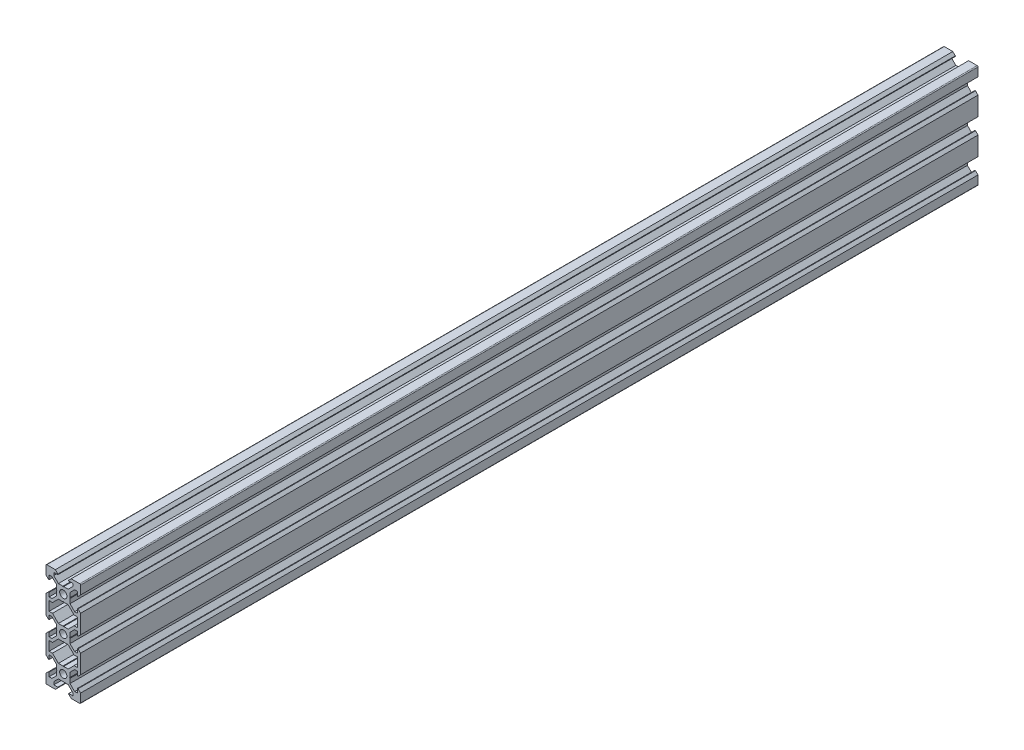
from build123d import *

# Parameters (mm, degrees)
BOSS_EXTRU_1_DEPTH = 519.38


with BuildPart() as part:
    # Esquisse1 → Boss.-Extru.1 (new body)
    with BuildSketch(Plane.XY):
        with BuildLine():
            Line((-9.5, 10), (-4.58, 10))
            Line((-4.58, 10), (-3.125, 8.545))
            Line((-3.125, 8.545), (-3.125, 8.2))
            Line((-3.125, 8.2), (-5.5, 8.2))
            Line((-5.5, 8.2), (-5.5, 6.560660172))
            Line((-5.5, 6.560660172), (-2.839339828, 3.9))
            Line((-2.839339828, 3.9), (-0.21, 3.9))
            Line((-0.21, 3.9), (0, 3.69))
            Line((0, 3.69), (0, 2.1))
            ThreePointArc((0, 2.1), (-2.1, 0), (0, -2.1))
            Line((0, -2.1), (0, -3.69))
            Line((0, -3.69), (-0.21, -3.9))
            Line((-0.21, -3.9), (-2.839339828, -3.9))
            Line((-2.839339828, -3.9), (-6.239339828, -7.3))
            Line((-6.239339828, -7.3), (-8.2, -7.3))
            Line((-8.2, -7.3), (-8.2, -12.7))
            Line((-8.2, -12.7), (-6.239339828, -12.7))
            Line((-6.239339828, -12.7), (-2.839339828, -16.1))
            Line((-2.839339828, -16.1), (-0.21, -16.1))
            Line((-0.21, -16.1), (0, -16.31))
            Line((0, -16.31), (0, -17.9))
            ThreePointArc((0, -17.9), (-2.1, -20), (0, -22.1))
            Line((0, -22.1), (0, -23.69))
            Line((0, -23.69), (-0.21, -23.9))
            Line((-0.21, -23.9), (-2.839339828, -23.9))
            Line((-2.839339828, -23.9), (-6.239339828, -27.3))
            Line((-6.239339828, -27.3), (-8.2, -27.3))
            Line((-8.2, -27.3), (-8.2, -32.7))
            Line((-8.2, -32.7), (-6.239339828, -32.7))
            Line((-6.239339828, -32.7), (-2.839339828, -36.1))
            Line((-2.839339828, -36.1), (-0.21, -36.1))
            Line((-0.21, -36.1), (0, -36.31))
            Line((0, -36.31), (0, -37.9))
            ThreePointArc((0, -37.9), (-2.1, -40), (0, -42.1))
            Line((0, -42.1), (0, -43.69))
            Line((0, -43.69), (-0.21, -43.9))
            Line((-0.21, -43.9), (-2.839339828, -43.9))
            Line((-2.839339828, -43.9), (-5.5, -46.560660172))
            Line((-5.5, -46.560660172), (-5.5, -48.2))
            Line((-5.5, -48.2), (-3.125, -48.2))
            Line((-3.125, -48.2), (-3.125, -48.545))
            Line((-3.125, -48.545), (-4.58, -50))
            Line((-4.58, -50), (-9.5, -50))
            ThreePointArc((-9.5, -50), (-9.853553391, -49.853553391), (-10, -49.5))
            Line((-10, -49.5), (-10, -44.58))
            Line((-10, -44.58), (-8.545, -43.125))
            Line((-8.545, -43.125), (-8.2, -43.125))
            Line((-8.2, -43.125), (-8.2, -45.5))
            Line((-8.2, -45.5), (-6.560660172, -45.5))
            Line((-6.560660172, -45.5), (-3.9, -42.839339828))
            Line((-3.9, -42.839339828), (-3.9, -40.21))
            Line((-3.9, -40.21), (-3.69, -40))
            Line((-3.69, -40), (-3.9, -39.79))
            Line((-3.9, -39.79), (-3.9, -37.160660172))
            Line((-3.9, -37.160660172), (-6.560660172, -34.5))
            Line((-6.560660172, -34.5), (-8.2, -34.5))
            Line((-8.2, -34.5), (-8.2, -36.875))
            Line((-8.2, -36.875), (-8.545, -36.875))
            Line((-8.545, -36.875), (-10, -35.42))
            Line((-10, -35.42), (-10, -24.58))
            Line((-10, -24.58), (-8.545, -23.125))
            Line((-8.545, -23.125), (-8.2, -23.125))
            Line((-8.2, -23.125), (-8.2, -25.5))
            Line((-8.2, -25.5), (-6.560660172, -25.5))
            Line((-6.560660172, -25.5), (-3.9, -22.839339828))
            Line((-3.9, -22.839339828), (-3.9, -20.21))
            Line((-3.9, -20.21), (-3.69, -20))
            Line((-3.69, -20), (-3.9, -19.79))
            Line((-3.9, -19.79), (-3.9, -17.160660172))
            Line((-3.9, -17.160660172), (-6.560660172, -14.5))
            Line((-6.560660172, -14.5), (-8.2, -14.5))
            Line((-8.2, -14.5), (-8.2, -16.875))
            Line((-8.2, -16.875), (-8.545, -16.875))
            Line((-8.545, -16.875), (-10, -15.42))
            Line((-10, -15.42), (-10, -4.58))
            Line((-10, -4.58), (-8.545, -3.125))
            Line((-8.545, -3.125), (-8.2, -3.125))
            Line((-8.2, -3.125), (-8.2, -5.5))
            Line((-8.2, -5.5), (-6.560660172, -5.5))
            Line((-6.560660172, -5.5), (-3.9, -2.839339828))
            Line((-3.9, -2.839339828), (-3.9, -0.21))
            Line((-3.9, -0.21), (-3.69, 0))
            Line((-3.69, 0), (-3.9, 0.21))
            Line((-3.9, 0.21), (-3.9, 2.839339828))
            Line((-3.9, 2.839339828), (-6.560660172, 5.5))
            Line((-6.560660172, 5.5), (-8.2, 5.5))
            Line((-8.2, 5.5), (-8.2, 3.125))
            Line((-8.2, 3.125), (-8.545, 3.125))
            Line((-8.545, 3.125), (-10, 4.58))
            Line((-10, 4.58), (-10, 9.5))
            ThreePointArc((-10, 9.5), (-9.853553391, 9.853553391), (-9.5, 10))
        make_face()
    boss_extru_1 = extrude(amount=BOSS_EXTRU_1_DEPTH)

    # Symétrie1: Boss.-Extru.1 across plane
    add(boss_extru_1.mirror(Plane(origin=(0, 3.69, 519.38), x_dir=(0, 0, 1), z_dir=(-1, 0, 0))))


solid = part.part
